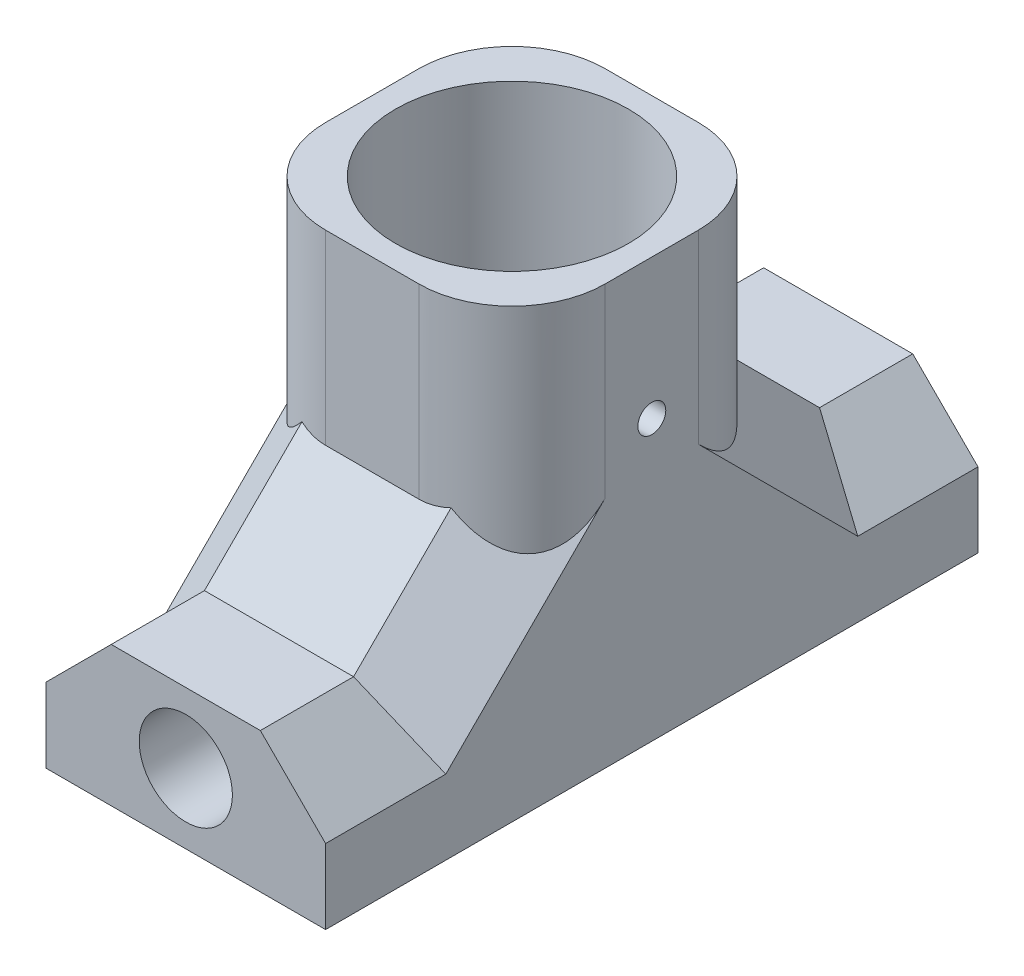
from build123d import *

# Parameters (mm, degrees)
EXTRUDE_1_DEPTH     = 30
SKETCH_2_R          = 12.5
CUT_EXTRUDE_1_DEPTH = 30
SKETCH_3_R          = 5
CUT_EXTRUDE_2_DEPTH = 89.459030065
CHAMFER_1_SIZE      = 10
FILLET_1_R          = 10
CHAMFER_2_SIZE      = 7
SKETCH_4_R          = 1.5
CUT_EXTRUDE_3_DEPTH = 89.459030065


with BuildPart() as part:
    # 草圖1 → 填料-伸長1 (new body)
    with BuildSketch(Plane(origin=(0, 0, 0), x_dir=(0, 0, -1), z_dir=(1, 0, 0))):
        Polygon((50, 15), (70, 15), (70, 0), (0, 0), (0, 15), (20, 15), (20, 45), (50, 45), align=None)
    extrude(amount=EXTRUDE_1_DEPTH)

    # 草圖2 → 除料-伸長1 (cut)
    with BuildSketch(Plane(origin=(0, 45, 0), x_dir=(1, 0, 0), z_dir=(0, 1, 0))):
        with Locations(Location((15, 35, 0), (0, 0, 270))):
            Circle(SKETCH_2_R)
    extrude(amount=-CUT_EXTRUDE_1_DEPTH, mode=Mode.SUBTRACT)

    # 草圖3 → 除料-伸長2 (cut, through all)
    with BuildSketch(Plane.XY):
        with Locations((15, 7.5)):
            Circle(SKETCH_3_R)
    extrude(amount=-CUT_EXTRUDE_2_DEPTH, mode=Mode.SUBTRACT)

    # 導角1
    chamfer_1_edges = [part.edges().sort_by_distance(p)[0] for p in [
        (15, 15, -20),
        (15, 15, -50),
    ]]
    chamfer(chamfer_1_edges, length=CHAMFER_1_SIZE)

    # 圓角1
    fillet_1_edges = [part.edges().sort_by_distance(p)[0] for p in [
        (30, 35, -20),
        (0, 35, -50),
        (30, 35, -50),
        (0, 35, -20),
    ]]
    fillet(fillet_1_edges, radius=FILLET_1_R)

    # 導角2
    chamfer_2_edges = [part.edges().sort_by_distance(p)[0] for p in [
        (0, 15, -5),
        (0, 25, -20),
        (0, 15, -65),
        (0, 25, -50),
        (30, 15, -65),
        (30, 25, -50),
        (30, 15, -5),
        (30, 25, -20),
    ]]
    chamfer(chamfer_2_edges, length=CHAMFER_2_SIZE)

    # 草圖4 → 除料-伸長3 (cut, through all)
    with BuildSketch(Plane(origin=(30, 0, 0), x_dir=(0, 0, -1), z_dir=(1, 0, 0))):
        with Locations((35, 30)):
            Circle(SKETCH_4_R)
    extrude(amount=-CUT_EXTRUDE_3_DEPTH, mode=Mode.SUBTRACT)


solid = part.part
